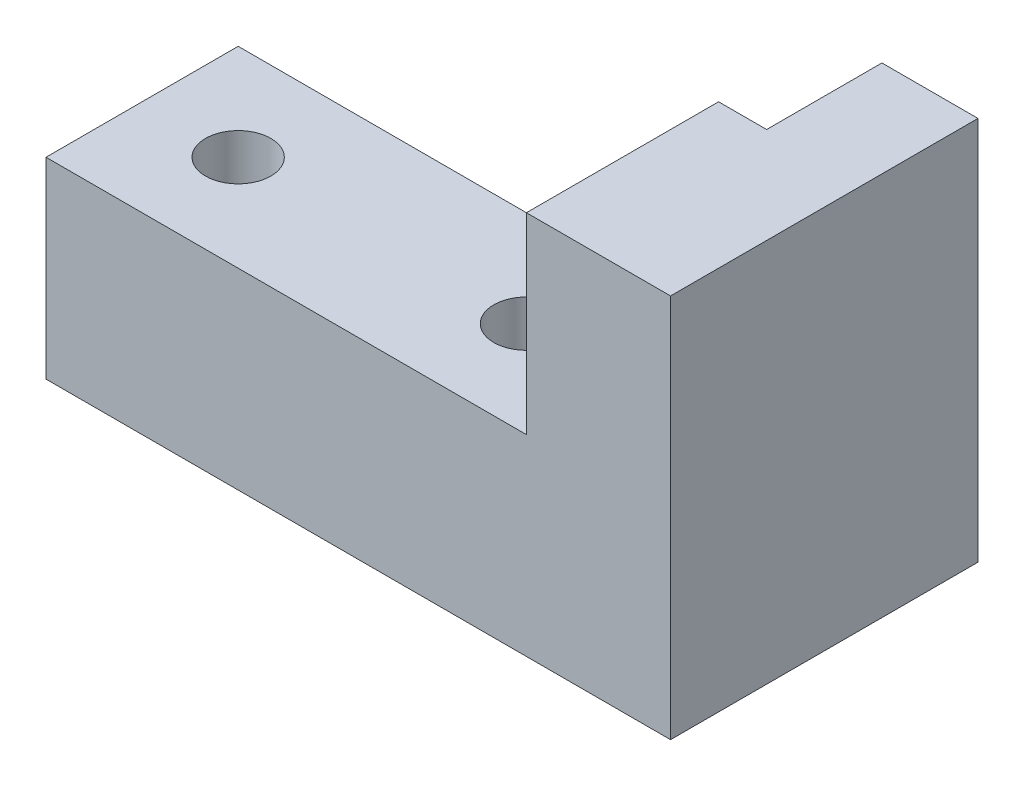
from build123d import *

# Parameters (mm, degrees)
SKETCH1_W           = 25
SKETCH1_H           = 10
SKETCH1_R           = 1.7
BOSS_EXTRUDE1_DEPTH = 10
BOSS_EXTRUDE2_DEPTH = 20


with BuildPart() as part:
    # Sketch1 → Boss-Extrude1 (new body)
    with BuildSketch(Plane(origin=(0, 0, 0), x_dir=(1, 0, 0), z_dir=(0, 1, 0))):
        Rectangle(SKETCH1_W, SKETCH1_H)
        with Locations(Location((-7.5, 0, 0), (0, 0, 270))):
            Circle(SKETCH1_R, mode=Mode.SUBTRACT)
        with Locations(Location((7.5, 0, 0), (0, 0, 270))):
            Circle(SKETCH1_R, mode=Mode.SUBTRACT)
    extrude(amount=BOSS_EXTRUDE1_DEPTH)

    # Sketch2 → Boss-Extrude2 (add)
    with BuildSketch(Plane(origin=(0, 0, 0), x_dir=(1, 0, 0), z_dir=(0, 1, 0))):
        Polygon((12.5, -5), (20, -5), (20, 11), (15, 11), (15, 5), (12.5, 5), align=None)
    extrude(amount=BOSS_EXTRUDE2_DEPTH)


solid = part.part
